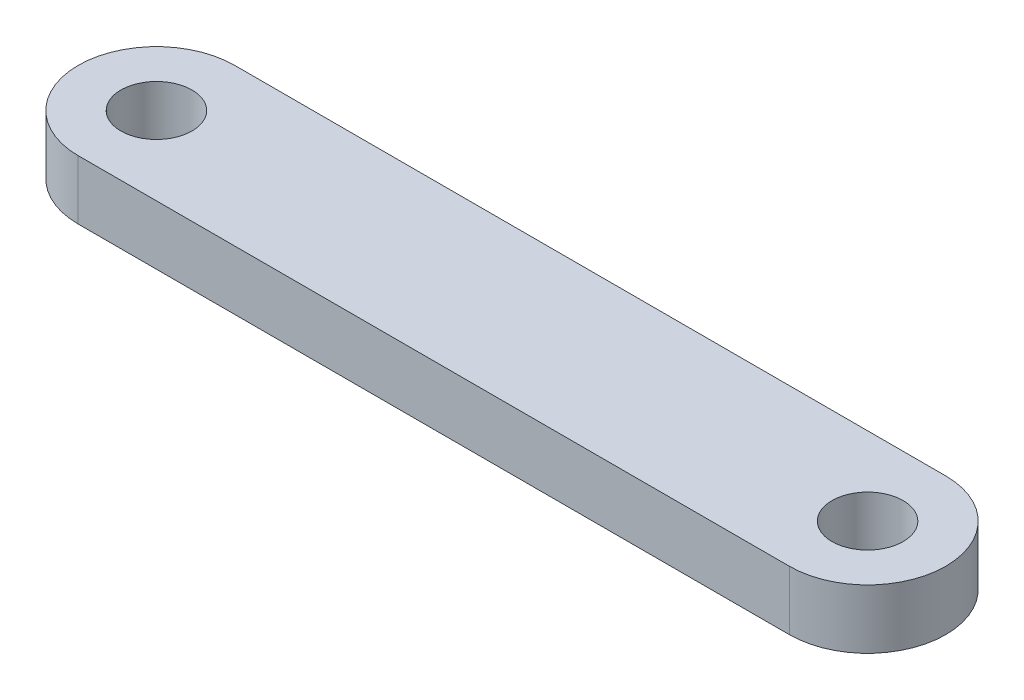
from build123d import *

# Parameters (mm, degrees)
SKETCH2_R           = 7.62
BOSS_EXTRUDE1_DEPTH = 12.7


with BuildPart() as part:
    # Sketch2 → Boss-Extrude1 (new body)
    with BuildSketch(Plane(origin=(0, 0, 0), x_dir=(1, 0, 0), z_dir=(0, 1, 0))):
        with BuildLine():
            Line((0, 16.764), (152.4, 16.764))
            ThreePointArc((152.4, 16.764), (169.164, 0), (152.4, -16.764))
            Line((152.4, -16.764), (0, -16.764))
            ThreePointArc((0, -16.764), (-16.764, 0), (0, 16.764))
        make_face()
        with Locations(Location((0, 0, 0), (0, 0, 270))):
            Circle(SKETCH2_R, mode=Mode.SUBTRACT)
        with Locations(Location((152.4, 0, 0), (0, 0, 270))):
            Circle(SKETCH2_R, mode=Mode.SUBTRACT)
    extrude(amount=BOSS_EXTRUDE1_DEPTH)


solid = part.part
